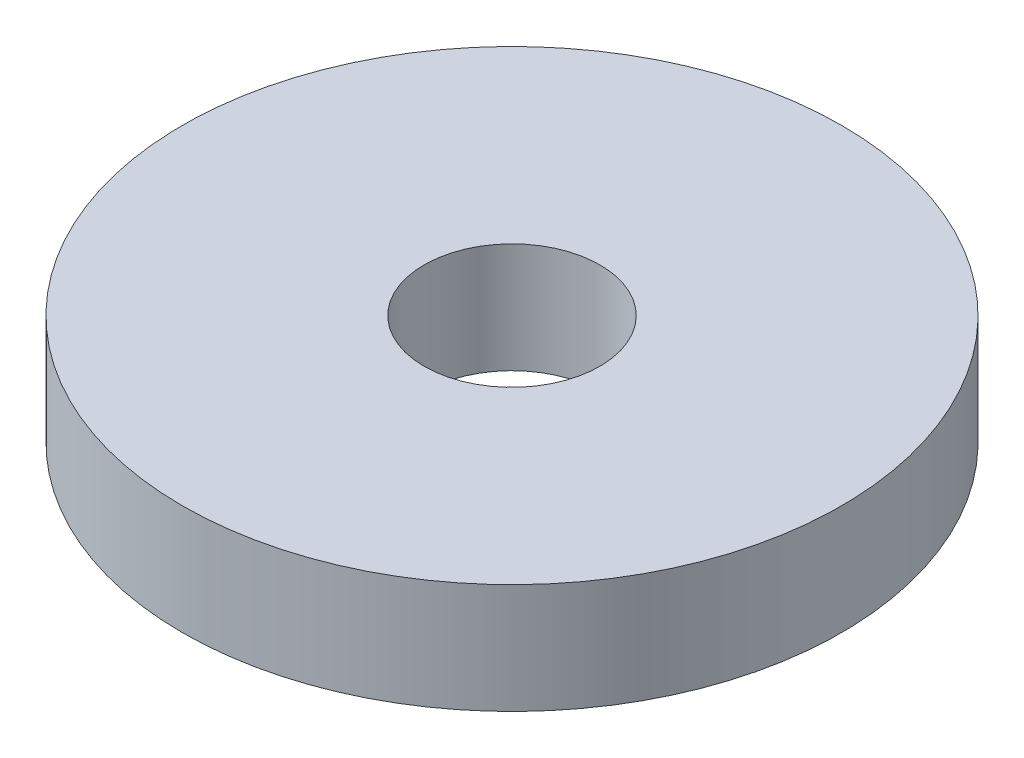
from build123d import *

# Parameters (mm, degrees)
SKETCH1_R           = 15
SKETCH1_R_2         = 4
BOSS_EXTRUDE2_DEPTH = 2.5


with BuildPart() as part:
    # Sketch1 → Boss-Extrude2 (new, symmetric)
    with BuildSketch(Plane(origin=(0, 0, 0), x_dir=(1, 0, 0), z_dir=(0, 1, 0))):
        with Locations(Location((0, 0, 0), (0, 0, 270))):
            Circle(SKETCH1_R)
        with Locations(Location((0, 0, 0), (0, 0, 270))):
            Circle(SKETCH1_R_2, mode=Mode.SUBTRACT)
    extrude(amount=BOSS_EXTRUDE2_DEPTH, both=True)


solid = part.part
